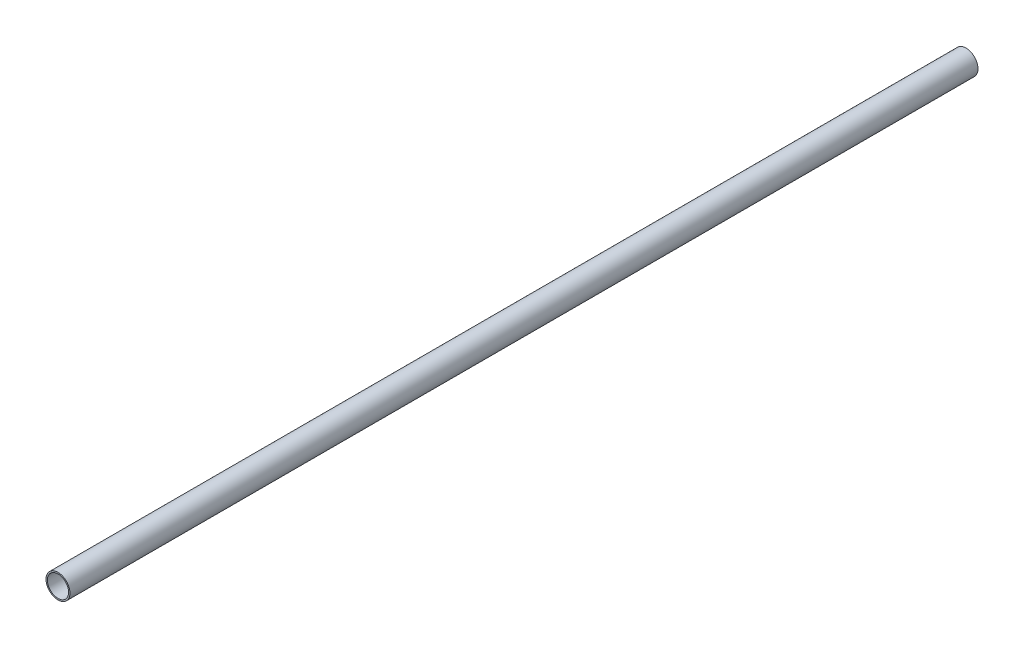
from build123d import *

# Parameters (mm, degrees)
BOSS_EXTRUDE1_DEPTH      = 914.4
BOSS_EXTRUDE1_DEPTH_BACK = 914.4
SKETCH3_R                = 24.13
SKETCH3_R_2              = 21.3614


with BuildPart() as part:
    # Sketch3 → Boss-Extrude1 (new, two sides: drawn at the far end of the back side and taken through both)
    with BuildSketch(Plane.XY.offset(-BOSS_EXTRUDE1_DEPTH_BACK)):
        with Locations(Location((0, 0, 0), (0, 0, 180))):
            Circle(SKETCH3_R)
        with Locations(Location((0, 0, 0), (0, 0, 180))):
            Circle(SKETCH3_R_2, mode=Mode.SUBTRACT)
    extrude(amount=BOSS_EXTRUDE1_DEPTH + BOSS_EXTRUDE1_DEPTH_BACK)


solid = part.part
